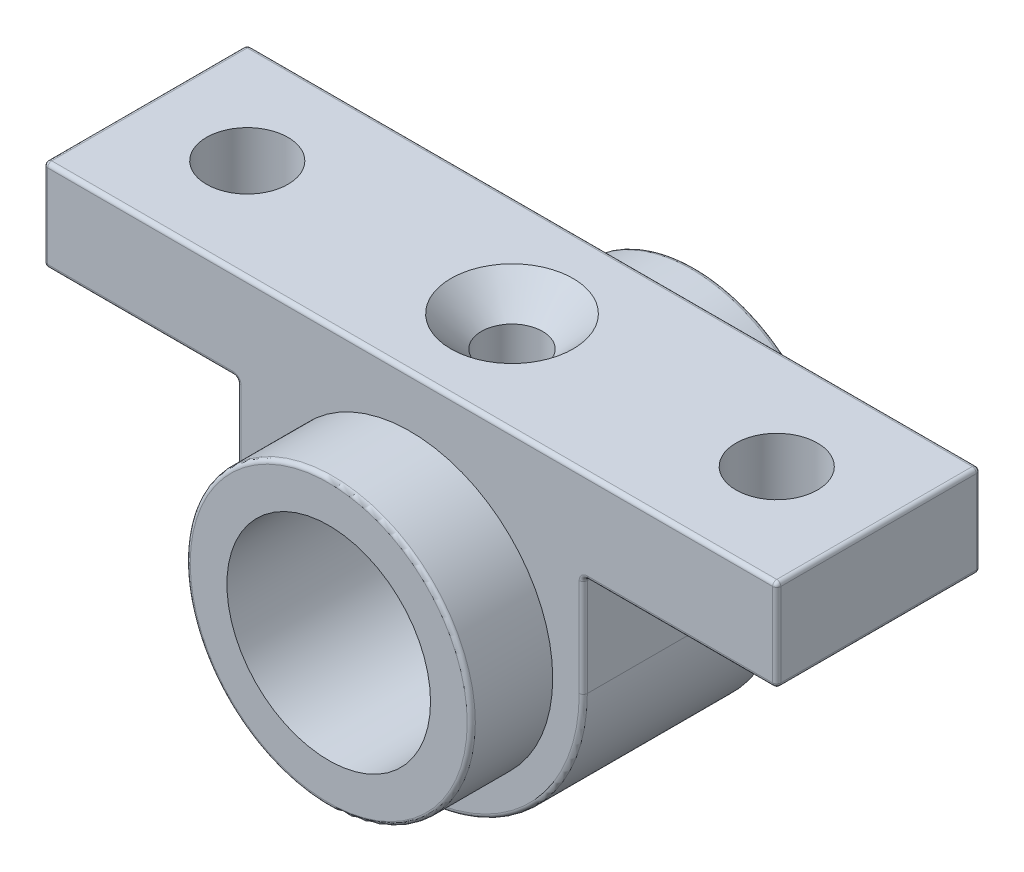
from build123d import *

# Parameters (mm, degrees)
SKETCH1_R                                       = 5
BOSS_EXTRUDE1_DEPTH                             = 5
SKETCH2_R                                       = 7
BOSS_EXTRUDE2_DEPTH                             = 4
CUT_EXTRUDE1_START                              = -4
SKETCH3_R                                       = 5
CUT_EXTRUDE1_DEPTH                              = 4
SKETCH5_R                                       = 2
CUT_EXTRUDE2_DEPTH                              = 28
CSK_FOR_M3_FLAT_HEAD_MACHINE_SCREW1_D           = 3
CSK_FOR_M3_FLAT_HEAD_MACHINE_SCREW1_DEPTH       = 8.098709071
CSK_FOR_M3_FLAT_HEAD_MACHINE_SCREW1_CSINK_D     = 6
CSK_FOR_M3_FLAT_HEAD_MACHINE_SCREW1_CSINK_ANGLE = 90
CSK_FOR_M3_FLAT_HEAD_MACHINE_SCREW1_TIP         = 0.901290929
FILLET1_R                                       = 0.2


with BuildPart() as part:
    # Sketch1 → Boss-Extrude1 (new, symmetric)
    with BuildSketch(Plane.XY):
        with BuildLine():
            Line((-8.5, 0), (-8.5, 5))
            Line((-8.5, 5), (-18, 5))
            Line((-18, 5), (-18, 9.5))
            Line((-18, 9.5), (18, 9.5))
            Line((18, 9.5), (18, 5))
            Line((18, 5), (8.5, 5))
            Line((8.5, 5), (8.5, 0))
            ThreePointArc((8.5, 0), (0, -8.5), (-8.5, 0))
        make_face()
        Circle(SKETCH1_R, mode=Mode.SUBTRACT)
    extrude(amount=BOSS_EXTRUDE1_DEPTH, both=True)

    # Sketch2 → Boss-Extrude2 (add)
    with BuildSketch(Plane.XY.offset(5)):
        Circle(SKETCH2_R)
    boss_extrude2 = extrude(amount=BOSS_EXTRUDE2_DEPTH)

    # Sketch3 → Cut-Extrude1 (cut)
    with BuildSketch(Plane.XY.offset(9).offset(CUT_EXTRUDE1_START)):
        Circle(SKETCH3_R)
    cut_extrude1 = extrude(amount=CUT_EXTRUDE1_DEPTH, mode=Mode.SUBTRACT)

    # Mirror1: Boss-Extrude2, Cut-Extrude1 across plane
    add(boss_extrude2.mirror(Plane.XY))
    add(cut_extrude1.mirror(Plane.XY), mode=Mode.SUBTRACT)

    # Sketch5 → Cut-Extrude2 (cut, through all)
    with BuildSketch(Plane(origin=(0, 9.5, 0), x_dir=(1, 0, 0), z_dir=(0, 1, 0))):
        with Locations(Location((-13, 0, 0), (0, 0, 270))):
            Circle(SKETCH5_R)
        with Locations(Location((13, 0, 0), (0, 0, 270))):
            Circle(SKETCH5_R)
    extrude(amount=-CUT_EXTRUDE2_DEPTH, mode=Mode.SUBTRACT)

    # CSK for M3 Flat Head Machine Screw1
    with Locations(Plane(origin=(0, 9.5, 0), x_dir=(1, 0, 0), z_dir=(0, 1, 0))):
        with Locations((0, 0)):
            CounterSinkHole(CSK_FOR_M3_FLAT_HEAD_MACHINE_SCREW1_D / 2, CSK_FOR_M3_FLAT_HEAD_MACHINE_SCREW1_CSINK_D / 2, depth=CSK_FOR_M3_FLAT_HEAD_MACHINE_SCREW1_DEPTH, counter_sink_angle=CSK_FOR_M3_FLAT_HEAD_MACHINE_SCREW1_CSINK_ANGLE)
            with Locations((0, 0, -(CSK_FOR_M3_FLAT_HEAD_MACHINE_SCREW1_DEPTH + CSK_FOR_M3_FLAT_HEAD_MACHINE_SCREW1_TIP / 2))):  # 118° drill point
                Cone(0, CSK_FOR_M3_FLAT_HEAD_MACHINE_SCREW1_D / 2, CSK_FOR_M3_FLAT_HEAD_MACHINE_SCREW1_TIP, mode=Mode.SUBTRACT)

    # Fillet1
    fillet1_edges = [part.edges().sort_by_distance(p)[0] for p in [
        (18, 7.25, -5),
        (13.25, 5, -5),
        (8.5, 2.5, -5),
        (0, -8.5, -5),
        (13.25, 5, 5),
        (-8.5, 5, 0),
        (-18, 5, 0),
        (-18, 9.5, 0),
        (18, 9.5, 0),
        (18, 5, 0),
        (8.5, 5, 0),
        (18, 7.25, 5),
        (0, 9.5, 5),
        (-18, 7.25, 5),
        (-13.25, 5, 5),
        (-7, 0, 9),
        (-8.5, 2.5, 5),
        (-7, 0, -9),
        (0, -8.5, 5),
        (-8.5, 2.5, -5),
        (8.5, 2.5, 5),
        (-13.25, 5, -5),
        (-18, 7.25, -5),
        (0, 9.5, -5),
    ]]
    fillet(fillet1_edges, radius=FILLET1_R)


solid = part.part
